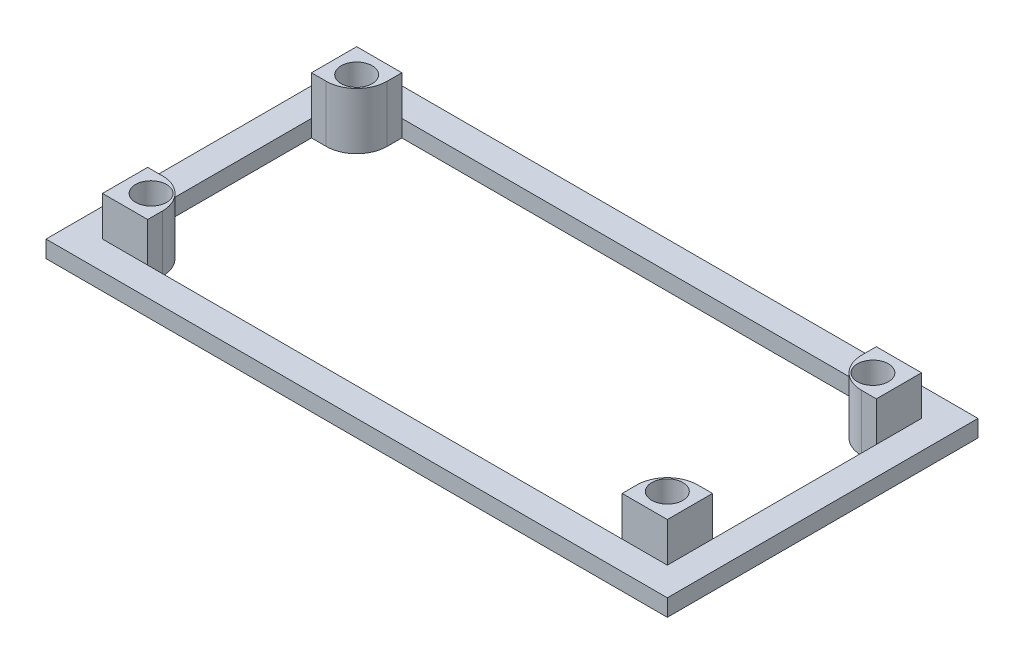
from build123d import *

# Parameters (mm, degrees)
SKETCH1_W                                  = 110
SKETCH1_H                                  = 55
SKETCH1_W_2                                = 100
SKETCH1_H_2                                = 45
BOSS_EXTRUDE1_DEPTH                        = 3
BOSS_EXTRUDE2_START                        = -3
SKETCH2_R                                  = 2.75
BOSS_EXTRUDE2_DEPTH                        = 10
MIRROR1_START                              = -3
MIRROR1_AT_THE_SECOND_PLANE_COPY_1_SKETC_R = 2.75
MIRROR1_AT_THE_SECOND_PLANE_COPY_1_DEPTH   = 10


with BuildPart() as part:
    # Sketch1 → Boss-Extrude1 (new body)
    with BuildSketch(Plane(origin=(0, 0, 0), x_dir=(1, 0, 0), z_dir=(0, 1, 0))):
        Rectangle(SKETCH1_W, SKETCH1_H)
        Rectangle(SKETCH1_W_2, SKETCH1_H_2, mode=Mode.SUBTRACT)
    extrude(amount=BOSS_EXTRUDE1_DEPTH)

    # Sketch2 → Boss-Extrude2 (add)
    with BuildSketch(Plane(origin=(0, 3, 0), x_dir=(1, 0, 0), z_dir=(0, 1, 0)).offset(BOSS_EXTRUDE2_START)):
        with BuildLine():
            Line((-50, -22.5), (-42, -22.5))
            Line((-42, -22.5), (-42, -19.889949494))
            ThreePointArc((-42, -19.889949494), (-43.578679656, -16.078679656), (-47.389949494, -14.5))
            Line((-47.389949494, -14.5), (-50, -14.5))
            Line((-50, -14.5), (-50, -22.5))
        make_face()
        with Locations(Location((-45.7, -18.2, 0), (0, 0, 270))):
            Circle(SKETCH2_R, mode=Mode.SUBTRACT)
    boss_extrude2 = extrude(amount=BOSS_EXTRUDE2_DEPTH)

    # Mirror1: Boss-Extrude2 across plane
    add(boss_extrude2.mirror(Plane.XY))

    # Mirror1 at the second plane: Boss-Extrude2 across plane
    add(boss_extrude2.mirror(Plane(origin=(0, 0, 0), x_dir=(0, 0, 1), z_dir=(1, 0, 0))))

    # Mirror1 at the second plane copy 1 sketc → Mirror1 at the second plane copy 1 (add)
    with BuildSketch(Plane(origin=(0, 3, 0), x_dir=(-1, 0, 0), z_dir=(0, 1, 0)).offset(MIRROR1_START)):
        with BuildLine():
            Line((-50, -22.5), (-42, -22.5))
            Line((-42, -22.5), (-42, -19.889949494))
            ThreePointArc((-42, -19.889949494), (-43.578679656, -16.078679656), (-47.389949494, -14.5))
            Line((-47.389949494, -14.5), (-50, -14.5))
            Line((-50, -14.5), (-50, -22.5))
        make_face()
        with Locations(Location((-45.7, -18.2, 0), (0, 0, 270))):
            Circle(MIRROR1_AT_THE_SECOND_PLANE_COPY_1_SKETC_R, mode=Mode.SUBTRACT)
    extrude(amount=MIRROR1_AT_THE_SECOND_PLANE_COPY_1_DEPTH)


solid = part.part
